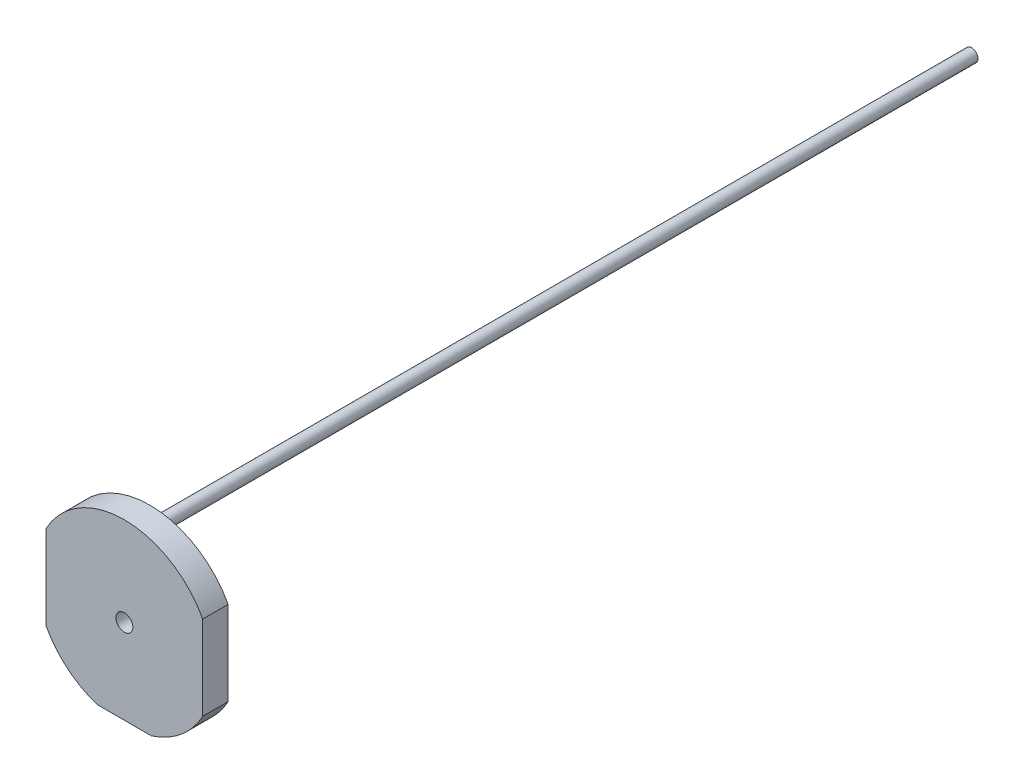
from build123d import *

# Parameters (mm, degrees)
SKETCH_1_R      = 2
SKETCH_1_R_2    = 1.5
EXTRUDE_1_DEPTH = 6
SKETCH_1_2_R    = 1.5
EXTRUDE_2_DEPTH = 200


with BuildPart() as part:
    # 草图1 → 凸台-拉伸1 (new body)
    with BuildSketch(Plane.XY):
        with BuildLine():
            Line((-6.403124237, -20), (6.403124237, -20))
            ThreePointArc((6.403124237, -20), (13.429663608, -16.144476931), (18.5, -9.937303457))
            Line((18.5, -9.937303457), (18.5, 9.937303457))
            ThreePointArc((18.5, 9.937303457), (0, 21), (-18.5, 9.937303457))
            Line((-18.5, 9.937303457), (-18.5, -9.937303457))
            ThreePointArc((-18.5, -9.937303457), (-13.429663608, -16.144476931), (-6.403124237, -20))
        make_face()
        Circle(SKETCH_1_R, mode=Mode.SUBTRACT)
        with Locations((0, 16)):
            Circle(SKETCH_1_R_2, mode=Mode.SUBTRACT)
    extrude(amount=-EXTRUDE_1_DEPTH)

    # 草图1<2> → 凸台-拉伸2 (add)
    with BuildSketch(Plane.XY):
        with Locations((0, 16)):
            Circle(SKETCH_1_2_R)
    extrude(amount=-EXTRUDE_2_DEPTH)


solid = part.part
